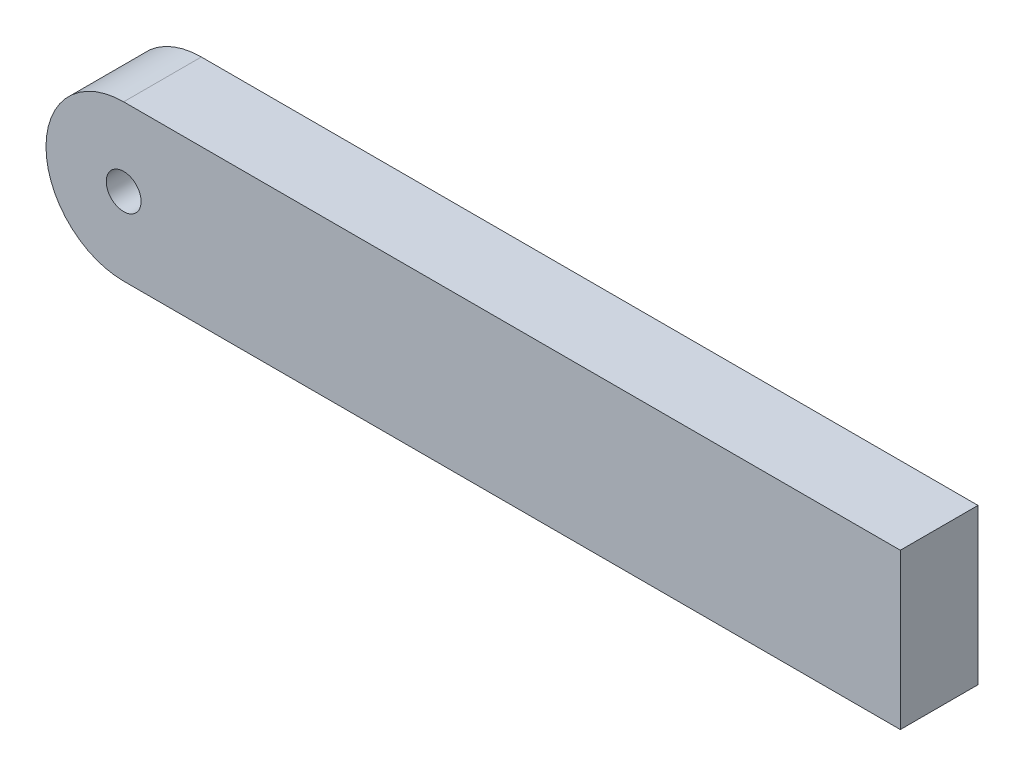
from build123d import *

# Parameters (mm, degrees)
BOSS_EXTRUDE1_DEPTH   = 10
BODY_MOVE_COPY1_ANGLE = 120


with BuildPart() as part:
    # Sketch1 → Boss-Extrude1 (new body)
    with BuildSketch(Plane(origin=(0, 0, 0), x_dir=(1, 0, 0), z_dir=(0, 1, 0))):
        with BuildLine():
            Line((-10, 0), (10, 0))
            Line((10, 0), (10, 100))
            ThreePointArc((10, 100), (0, 110), (-10, 100))
            Line((-10, 100), (-10, 0))
        make_face()
        with BuildLine():
            ThreePointArc((1.5875, 98.4125), (0, 97.75493597), (-1.5875, 98.4125))
            ThreePointArc((-1.5875, 98.4125), (-2.24506403, 100), (-1.5875, 101.5875))
            ThreePointArc((-1.5875, 101.5875), (0, 102.24506403), (1.5875, 101.5875))
            ThreePointArc((1.5875, 101.5875), (2.074168707, 100.859148809), (2.24506403, 100))
            ThreePointArc((2.24506403, 100), (2.074168707, 99.140851191), (1.5875, 98.4125))
        make_face(mode=Mode.SUBTRACT)
    extrude(amount=BOSS_EXTRUDE1_DEPTH)


with BuildPart() as part_1:
    # Body-Move/Copy1: moved
    add(part.part.moved(Location((0, 0, 0))).rotate(Axis((-1.666666667, 3.333333333, -1.666666667), (0.5773502691894747, 0.5773502691901298, 0.5773502691892728)), BODY_MOVE_COPY1_ANGLE))


with BuildPart() as part_2:
    # Body-Move/Copy2: moved
    add(part_1.part.moved(Location((100, -5, 0))))


solid = part_2.part
